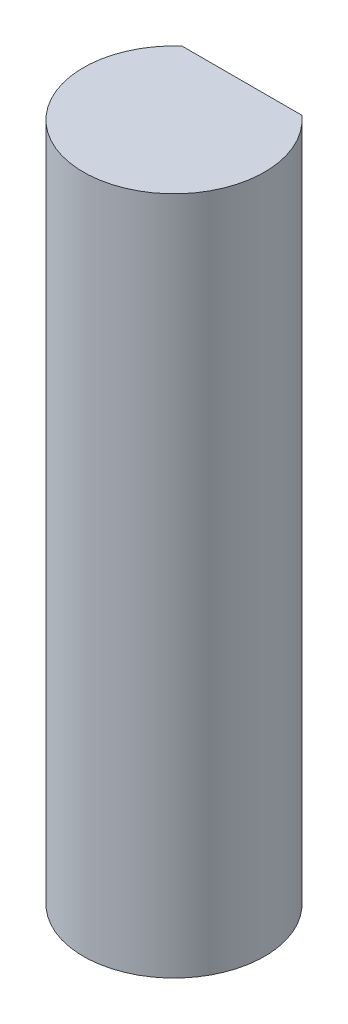
from build123d import *

# Parameters (mm, degrees)
BOSS_EXTRUDE1_DEPTH = 15


with BuildPart() as part:
    # Sketch1 → Boss-Extrude1 (new body)
    with BuildSketch(Plane(origin=(0, 0, 0), x_dir=(1, 0, 0), z_dir=(0, 1, 0))):
        with BuildLine():
            Line((1.322875656, 1.5), (-1.322875656, 1.5))
            ThreePointArc((-1.322875656, 1.5), (0, -2), (1.322875656, 1.5))
        make_face()
    extrude(amount=BOSS_EXTRUDE1_DEPTH)


solid = part.part
